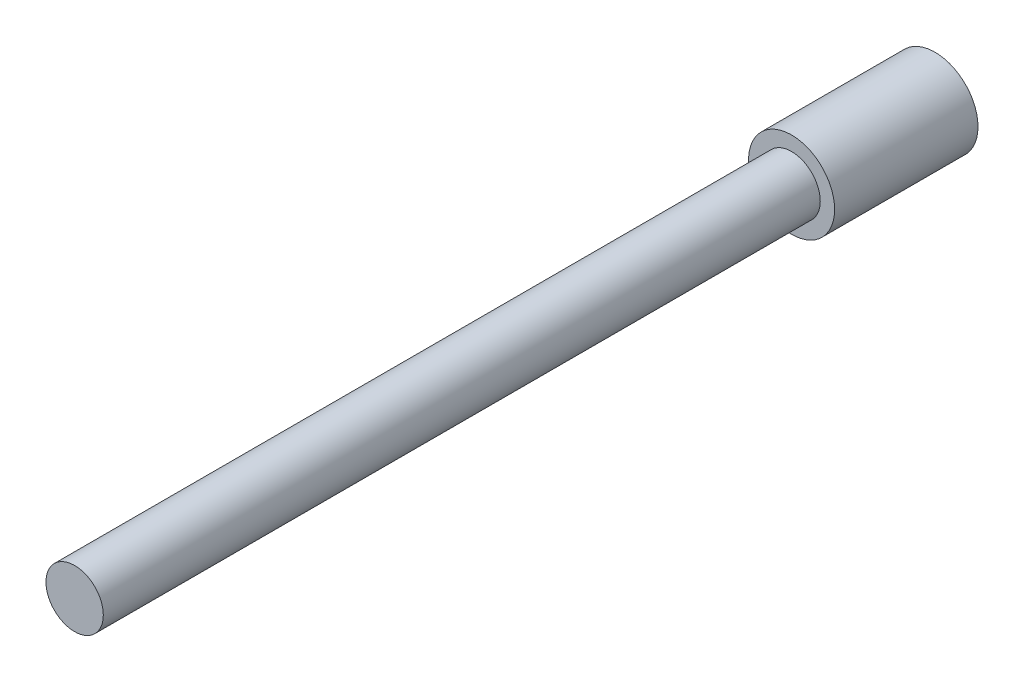
from build123d import *


with BuildPart() as part:
    # Sketch1 → Revolve1 (revolve)
    with BuildSketch(Plane(origin=(0, 0, 0), x_dir=(1, 0, 0), z_dir=(0, 1, 0))):
        Polygon((6, 20), (0, 20), (0, -100), (4, -100), (4, 0), (6, 0), align=None)
    revolve(axis=Axis((0, 0, -20), (0, 0, 1)))


solid = part.part
